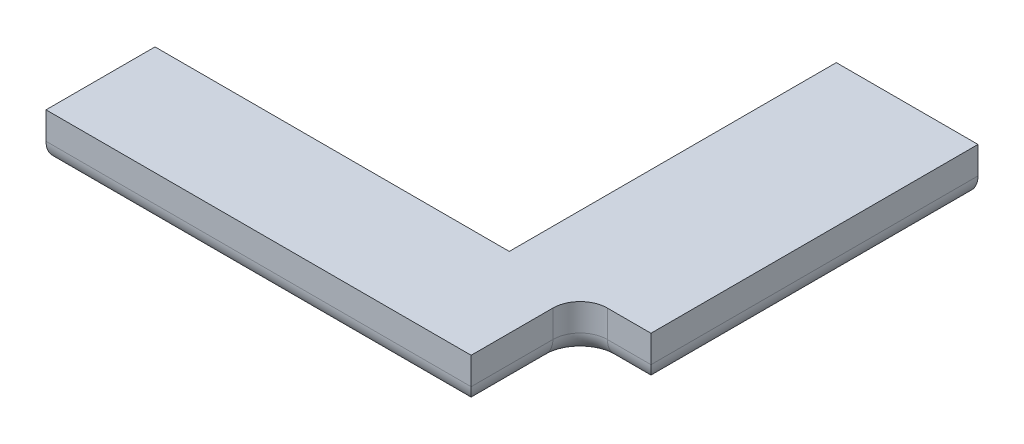
from build123d import *

# Parameters (mm, degrees)
EXTRUDE_1_DEPTH     = 9
FILLET_1_R          = 4
SKETCH_2_R          = 6
CUT_EXTRUDE_1_DEPTH = 3


with BuildPart() as part:
    # 草圖1 → 填料-伸長1 (new body)
    with BuildSketch(Plane(origin=(0, 0, 0), x_dir=(1, 0, 0), z_dir=(0, 1, 0))):
        with BuildLine():
            Line((0, 0), (65, 0))
            Line((65, 0), (65, 60))
            Line((65, 60), (91, 60))
            Line((91, 60), (91, 0))
            Line((91, 0), (83, 0))
            ThreePointArc((83, 0), (79.464466094, -1.464466094), (78, -5))
            Line((78, -5), (78, -20))
            Line((78, -20), (0, -20))
            Line((0, -20), (0, 0))
        make_face()
    extrude(amount=EXTRUDE_1_DEPTH)

    # 圓角1
    fillet_1_edges = [part.edges().sort_by_distance(p)[0] for p in [
        (87, 0, 0),
        (79.464466094, 0, 1.464466094),
        (78, 0, 12.5),
        (39, 0, 20),
        (91, 0, -30),
    ]]
    fillet(fillet_1_edges, radius=FILLET_1_R)

    # 草圖2 → 除料-伸長1 (cut)
    with BuildSketch(Plane.XZ):
        with Locations(Location((77, -50, 0), (0, 0, 270))):
            Circle(SKETCH_2_R)
        with Locations(Location((77, -30, 0), (0, 0, 270))):
            Circle(SKETCH_2_R)
    extrude(amount=-CUT_EXTRUDE_1_DEPTH, mode=Mode.SUBTRACT)


solid = part.part
